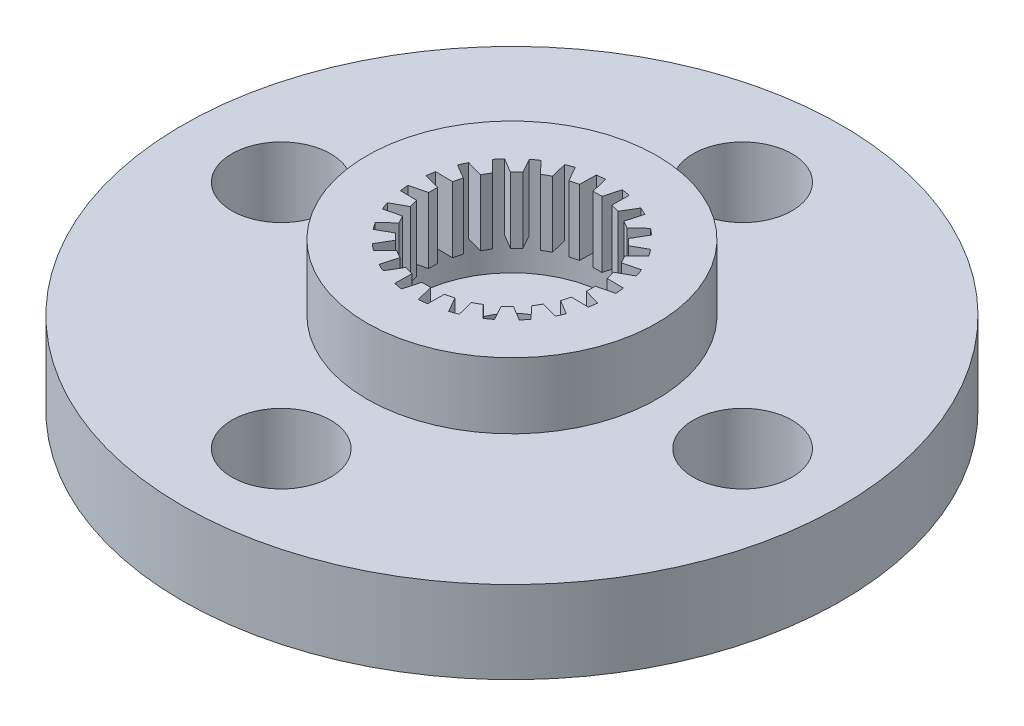
from build123d import *

# Parameters (mm, degrees)
SKETCH_4_R               = 10
EXTRUDE_2_DEPTH          = 2.5
SKETCH_6_R               = 1.5
CUT_EXTRUDE_9_DEPTH      = 2.5
SKETCH_7_R               = 4.4
EXTRUDE_3_DEPTH          = 2
SKETCH_8_R               = 3
CUT_EXTRUDE_10_DEPTH     = 3
EXTRUDE_5_DEPTH          = 2
PATTERN_CIRCULAR_1_COUNT = 24


with BuildPart() as part:
    # 草图4 → 凸台-拉伸2 (new body)
    with BuildSketch(Plane(origin=(0, 0, 0), x_dir=(1, 0, 0), z_dir=(0, 1, 0))):
        with Locations(Location((0, 0, 0), (0, 0, 270))):
            Circle(SKETCH_4_R)
    extrude(amount=EXTRUDE_2_DEPTH)

    # 草图6 → 切除-拉伸9 (cut)
    with BuildSketch(Plane(origin=(0, 2.5, 0), x_dir=(1, 0, 0), z_dir=(0, 1, 0))):
        with Locations(Location((0, 7, 0), (0, 0, 270))):
            Circle(SKETCH_6_R)
        with Locations(Location((0, 0, 0), (0, 0, 270))):
            Circle(SKETCH_6_R)
        with Locations(Location((7, 0, 0), (0, 0, 270))):
            Circle(SKETCH_6_R)
        with Locations(Location((-7, 0, 0), (0, 0, 270))):
            Circle(SKETCH_6_R)
        with Locations(Location((0, -7, 0), (0, 0, 270))):
            Circle(SKETCH_6_R)
    extrude(amount=-CUT_EXTRUDE_9_DEPTH, mode=Mode.SUBTRACT)

    # 草图7 → 凸台-拉伸3 (add)
    with BuildSketch(Plane(origin=(0, 2.5, 0), x_dir=(1, 0, 0), z_dir=(0, 1, 0))):
        with Locations(Location((0, 0, 0), (0, 0, 270))):
            Circle(SKETCH_7_R)
    extrude(amount=EXTRUDE_3_DEPTH)

    # 草图8 → 切除-拉伸10 (cut)
    with BuildSketch(Plane(origin=(0, 4.5, 0), x_dir=(1, 0, 0), z_dir=(0, 1, 0))):
        with Locations(Location((0, 0, 0), (0, 0, 270))):
            Circle(SKETCH_8_R)
    extrude(amount=-CUT_EXTRUDE_10_DEPTH, mode=Mode.SUBTRACT)

    # 草图14 → 凸台-拉伸5 (add)
    with BuildSketch(Plane(origin=(0, 4.5, 0), x_dir=(1, 0, 0), z_dir=(0, 1, 0))):
        with BuildLine():
            Line((2.976910005, -0.371492698), (2.495792863, -0.23538136))
            Line((2.495792863, -0.23538136), (2.495792863, 0.032272898))
            Line((2.495792863, 0.032272898), (2.995792863, 0.158824181))
            ThreePointArc((2.995792863, 0.158824181), (2.998100046, -0.106752588), (2.976910005, -0.371492698))
        make_face()
    extrude_5 = extrude(amount=-EXTRUDE_5_DEPTH)

    # 阵列(圆周)1: 凸台-拉伸5 ×24 about axis
    pattern_circular_1_axis = Axis((0, 0, 0), (0, 1, 0))
    for i in range(1, PATTERN_CIRCULAR_1_COUNT):
        add(extrude_5.rotate(pattern_circular_1_axis, i * 360 / PATTERN_CIRCULAR_1_COUNT))


solid = part.part
